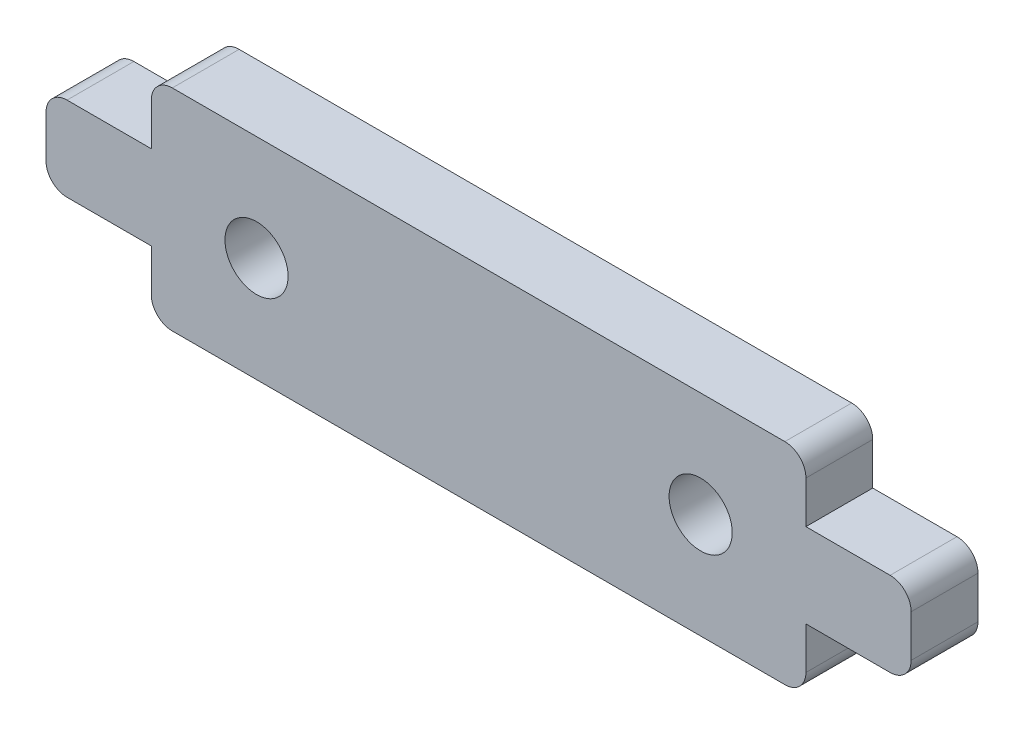
from build123d import *

# Parameters (mm, degrees)
BOSS_EXTRUDE1_DEPTH   = 3.175
F_3_0MM_DOWEL_HOLE1_D = 3
FILLET1_R             = 1


with BuildPart() as part:
    # Sketch1 → Boss-Extrude1 (new body)
    with BuildSketch(Plane.XY):
        Polygon((0, 2), (0, -2), (5, -2), (5, -5), (36.1, -5), (36.1, -2), (41.1, -2), (41.1, 2), (36.1, 2), (36.1, 5), (5, 5), (5, 2), align=None)
    extrude(amount=BOSS_EXTRUDE1_DEPTH)

    # Ø3.0mm Dowel Hole1 (through all)
    with Locations(Plane.XY.offset(3.175)):
        with Locations((10, 0), (31.1, 0)):
            Hole(F_3_0MM_DOWEL_HOLE1_D / 2)

    # Fillet1
    fillet1_edges = [part.edges().sort_by_distance(p)[0] for p in [
        (0, -2, 1.5875),
        (0, 2, 1.5875),
        (5, 5, 1.5875),
        (36.1, 5, 1.5875),
        (41.1, 2, 1.5875),
        (41.1, -2, 1.5875),
        (36.1, -5, 1.5875),
        (5, -5, 1.5875),
    ]]
    fillet(fillet1_edges, radius=FILLET1_R)


solid = part.part
